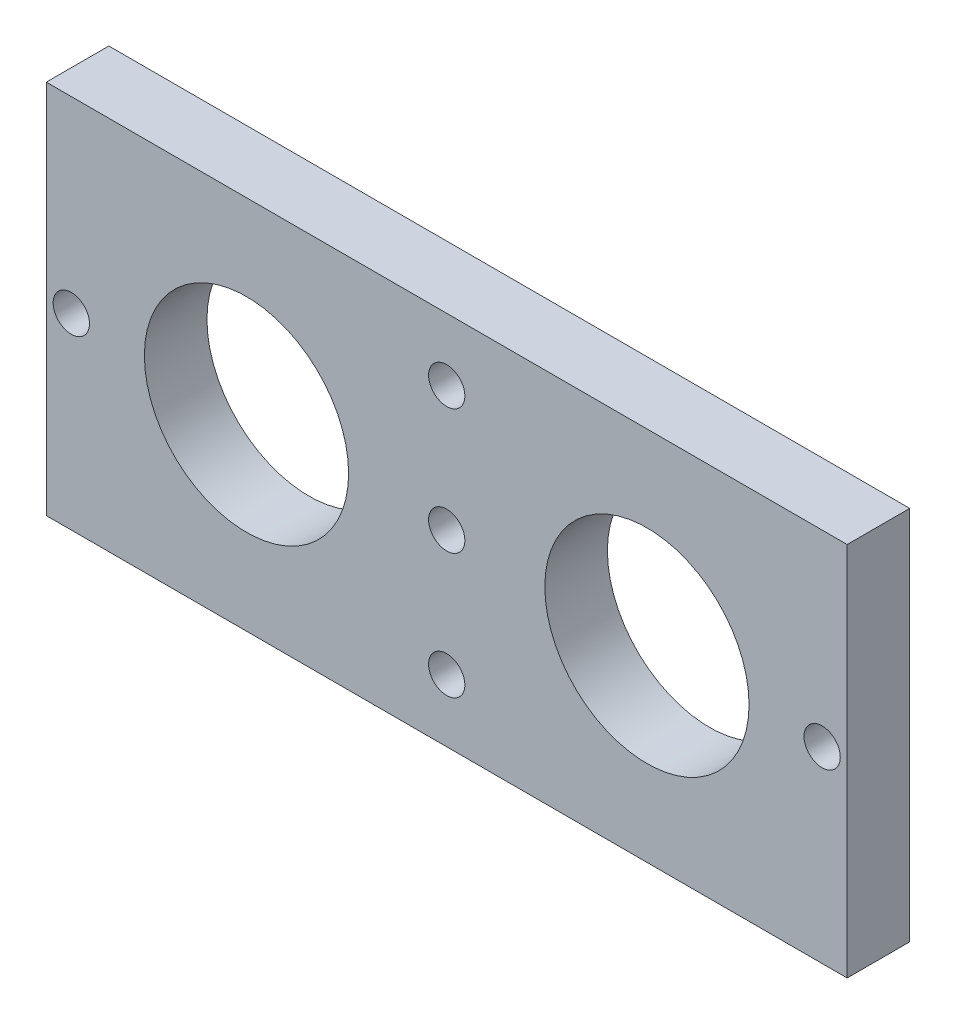
from build123d import *

# Parameters (mm, degrees)
SKETCH_1_W          = 64
SKETCH_1_H          = 30
SKETCH_1_R          = 8.16
EXTRUDE_1_DEPTH     = 5
SKETCH_2_R          = 1.45
CUT_EXTRUDE_1_DEPTH = 10


with BuildPart() as part:
    # 草图1 → 凸台-拉伸1 (new body)
    with BuildSketch(Plane.XY):
        with Locations((-6.884129186, 5.415137148)):
            Rectangle(SKETCH_1_W, SKETCH_1_H)
        with Locations((9.115870814, 5.415137148)):
            Circle(SKETCH_1_R, mode=Mode.SUBTRACT)
        with Locations((-22.884129186, 5.415137148)):
            Circle(SKETCH_1_R, mode=Mode.SUBTRACT)
    extrude(amount=EXTRUDE_1_DEPTH)

    # 草图2 → 切除-拉伸1 (cut)
    with BuildSketch(Plane.XY.offset(5)):
        with Locations((-6.884129186, 5.415137148)):
            Circle(SKETCH_2_R)
        with Locations((23.115870814, 5.415137148)):
            Circle(SKETCH_2_R)
        with Locations((-36.884129186, 5.415137148)):
            Circle(SKETCH_2_R)
        with Locations((-6.884129186, 15.415137148)):
            Circle(SKETCH_2_R)
        with Locations((-6.884129186, -4.584862852)):
            Circle(SKETCH_2_R)
    extrude(amount=-CUT_EXTRUDE_1_DEPTH, mode=Mode.SUBTRACT)


solid = part.part
